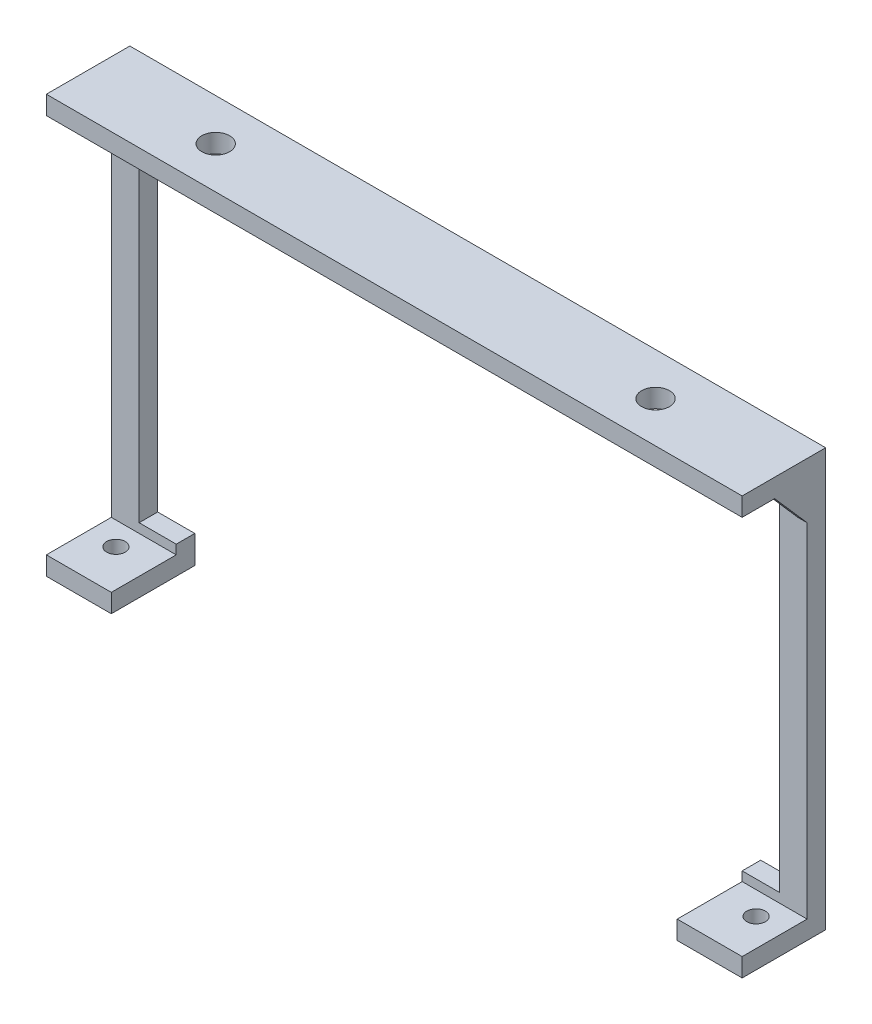
from build123d import *

# Parameters (mm, degrees)
BOSS_EXTRUDE1_DEPTH = 2
BOSS_EXTRUDE2_REACH = 89.487
SKETCH2_W           = 7
SKETCH2_H           = 2
BOSS_EXTRUDE3_DEPTH = 1
CUT_EXTRUDE1_REACH  = 89.926
SKETCH7_R           = 1.5
CUT_EXTRUDE2_REACH  = 89.926
SKETCH8_R           = 1
SKETCH10_W          = 61
SKETCH10_H          = 2
CUT_EXTRUDE3_DEPTH  = 88.74394566


with BuildPart() as part:
    # Sketch1 → Boss-Extrude1 (new body)
    with BuildSketch(Plane.XY):
        Polygon((3, 3), (7, 3), (7, 0), (0, 0), (0, 45), (75, 45), (75, 0), (68, 0), (68, 3), (72, 3), (72, 42), (3, 42), align=None)
    extrude(amount=BOSS_EXTRUDE1_DEPTH)

    # Boss-Extrude2: up to this face of the body (flat: up to its plane)
    boss_extrude2_end = Plane(part.part.faces().sort_by_distance((75, 22.5, 1))[0])
    # Sketch2 → Boss-Extrude2 (add, up to the picked face)
    with BuildSketch(Plane(origin=(0, 0, 0), x_dir=(0, 0, -1), z_dir=(1, 0, 0)), mode=Mode.PRIVATE) as boss_extrude2_sk1:
        with Locations((-5.5, 44)):
            Rectangle(SKETCH2_W, SKETCH2_H)
    boss_extrude2_tool1 = split(extrude(boss_extrude2_sk1.sketch, amount=BOSS_EXTRUDE2_REACH, mode=Mode.PRIVATE), bisect_by=boss_extrude2_end, keep=Keep.BOTH, mode=Mode.PRIVATE)
    # Sketch2 → Boss-Extrude2 (add, up to the picked face)
    with BuildSketch(Plane(origin=(0, 0, 0), x_dir=(0, 0, -1), z_dir=(1, 0, 0)), mode=Mode.PRIVATE) as boss_extrude2_sk2:
        with Locations((-5.5, 1)):
            Rectangle(SKETCH2_W, SKETCH2_H)
    boss_extrude2_tool2 = split(extrude(boss_extrude2_sk2.sketch, amount=BOSS_EXTRUDE2_REACH, mode=Mode.PRIVATE), bisect_by=boss_extrude2_end, keep=Keep.BOTH, mode=Mode.PRIVATE)
    add(boss_extrude2_tool1.solids().sort_by(Axis((0, 44, 5.5), (1, 0, 0)))[0])
    add(boss_extrude2_tool2.solids().sort_by(Axis((0, 1, 5.5), (1, 0, 0)))[0])

    # Sketch5 → Boss-Extrude3 (add)
    with BuildSketch(Plane.ZY):
        Polygon((5.5, 43), (2, 39), (2, 43), align=None)
    boss_extrude3 = extrude(amount=-BOSS_EXTRUDE3_DEPTH)

    # Mirror1: Boss-Extrude3 across plane
    add(boss_extrude3.mirror(Plane.ZY.offset(-37.5)))

    # Sketch7 → Cut-Extrude1 (cut, up to next)
    with BuildSketch(Plane(origin=(0, 45, 0), x_dir=(1, 0, 0), z_dir=(0, 1, 0)), mode=Mode.PRIVATE) as cut_extrude1_sk1:
        with Locations(Location((13.750043931, -4.494608683, 0), (0, 0, 270))):
            Circle(SKETCH7_R)
    cut_extrude1_tool1 = extrude(cut_extrude1_sk1.sketch, amount=-CUT_EXTRUDE1_REACH, mode=Mode.PRIVATE) & part.part
    # Sketch7 → Cut-Extrude1 (cut, up to next)
    with BuildSketch(Plane(origin=(0, 45, 0), x_dir=(1, 0, 0), z_dir=(0, 1, 0)), mode=Mode.PRIVATE) as cut_extrude1_sk2:
        with Locations(Location((61.249956069, -4.585969821, 0), (0, 0, 270))):
            Circle(SKETCH7_R)
    cut_extrude1_tool2 = extrude(cut_extrude1_sk2.sketch, amount=-CUT_EXTRUDE1_REACH, mode=Mode.PRIVATE) & part.part
    add(cut_extrude1_tool1.solids().sort_by_distance((13.750044, 45, 4.494609))[0], mode=Mode.SUBTRACT)
    add(cut_extrude1_tool2.solids().sort_by_distance((61.249956, 45, 4.58597))[0], mode=Mode.SUBTRACT)

    # Sketch8 → Cut-Extrude2 (cut, up to next)
    with BuildSketch(Plane.XZ, mode=Mode.PRIVATE) as cut_extrude2_sk1:
        with Locations(Location((3, 4.5, 0), (0, 0, 270))):
            Circle(SKETCH8_R)
    cut_extrude2_tool1 = extrude(cut_extrude2_sk1.sketch, amount=-CUT_EXTRUDE2_REACH, mode=Mode.PRIVATE) & part.part
    # Sketch8 → Cut-Extrude2 (cut, up to next)
    with BuildSketch(Plane.XZ, mode=Mode.PRIVATE) as cut_extrude2_sk2:
        with Locations(Location((72, 4.5, 0), (0, 0, 270))):
            Circle(SKETCH8_R)
    cut_extrude2_tool2 = extrude(cut_extrude2_sk2.sketch, amount=-CUT_EXTRUDE2_REACH, mode=Mode.PRIVATE) & part.part
    add(cut_extrude2_tool1.solids().sort_by_distance((3, 0, 4.5))[0], mode=Mode.SUBTRACT)
    add(cut_extrude2_tool2.solids().sort_by_distance((72, 0, 4.5))[0], mode=Mode.SUBTRACT)

    # Sketch10 → Cut-Extrude3 (cut, through all)
    with BuildSketch(Plane(origin=(0, 0, 2), x_dir=(-1, 0, 0), z_dir=(0, 0, -1))):
        with Locations((-37.5, 1)):
            Rectangle(SKETCH10_W, SKETCH10_H)
    extrude(amount=-CUT_EXTRUDE3_DEPTH, mode=Mode.SUBTRACT)


solid = part.part
